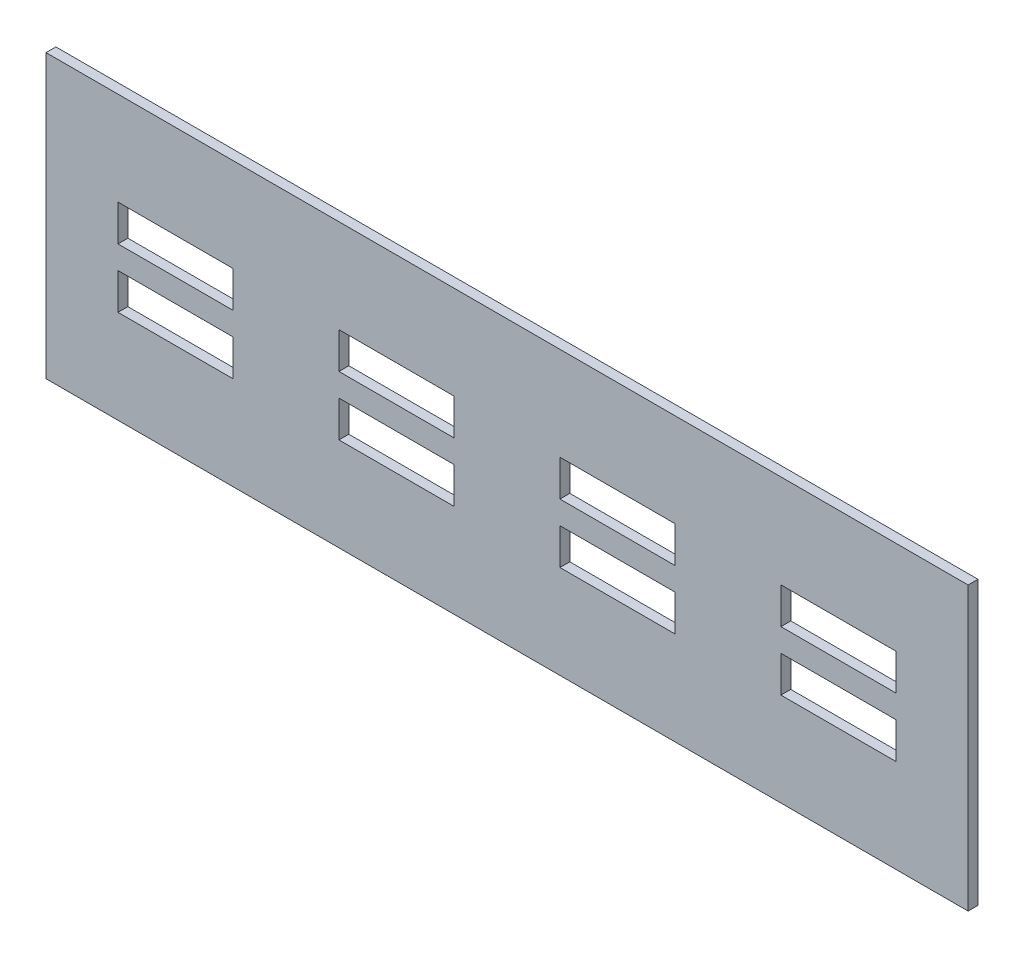
from build123d import *

# Parameters (mm, degrees)
ESBO_O1_W                = 280
ESBO_O1_H                = 85.763986188
RESSALTO_EXTRUS_O1_DEPTH = 3
ESBO_O2_W                = 35
ESBO_O2_H                = 11
CORTE_EXTRUS_O1_DEPTH    = 3


with BuildPart() as part:
    # Esboço1 → Ressalto-extrusão1 (new body)
    with BuildSketch(Plane.XY):
        with Locations((0, 12.118006906)):
            Rectangle(ESBO_O1_W, ESBO_O1_H)
    extrude(amount=RESSALTO_EXTRUS_O1_DEPTH)

    # Esboço2 → Corte-extrusão1 (cut)
    with BuildSketch(Plane.XY.offset(3)):
        with Locations((-100.65, 21.12)):
            Rectangle(ESBO_O2_W, ESBO_O2_H)
        with Locations((100.65, 3.12)):
            Rectangle(ESBO_O2_W, ESBO_O2_H)
        with Locations((100.65, 21.12)):
            Rectangle(ESBO_O2_W, ESBO_O2_H)
        with Locations((33.55, 3.12)):
            Rectangle(ESBO_O2_W, ESBO_O2_H)
        with Locations((33.55, 21.12)):
            Rectangle(ESBO_O2_W, ESBO_O2_H)
        with Locations((-33.55, 3.12)):
            Rectangle(ESBO_O2_W, ESBO_O2_H)
        with Locations((-33.55, 21.12)):
            Rectangle(ESBO_O2_W, ESBO_O2_H)
        with Locations((-100.65, 3.12)):
            Rectangle(ESBO_O2_W, ESBO_O2_H)
    extrude(amount=-CORTE_EXTRUS_O1_DEPTH, mode=Mode.SUBTRACT)


solid = part.part
